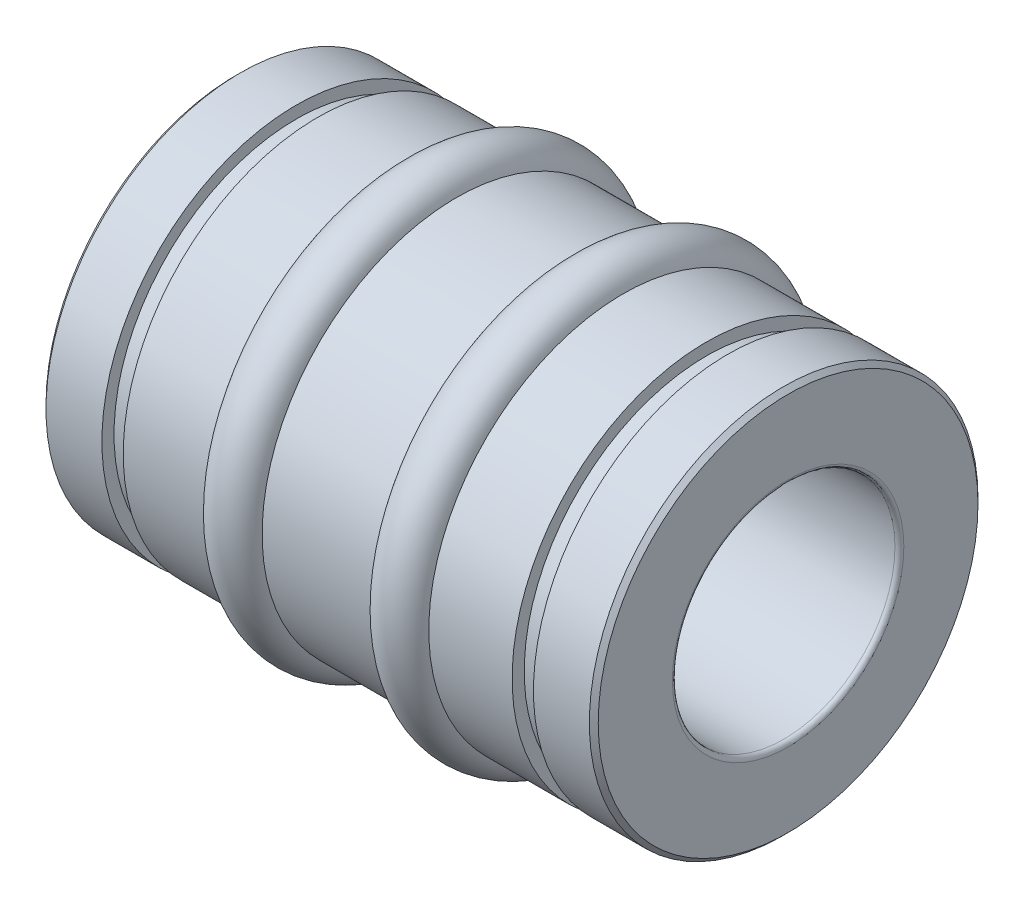
from build123d import *

# Parameters (mm, degrees)
SKETCH2_R = 1.5875


with BuildPart() as part:
    # Sketch1 → Revolve1 (revolve)
    with BuildSketch(Plane.XY, mode=Mode.PRIVATE) as revolve1_sk:
        with BuildLine():
            Line((-15.77975, 10.85215), (-15.77975, 6.61416))
            ThreePointArc((-15.77975, 6.61416), (-15.705355122, 6.434554878), (-15.52575, 6.36016))
            Line((-15.52575, 6.36016), (15.52575, 6.36016))
            ThreePointArc((15.52575, 6.36016), (15.705355122, 6.434554878), (15.77975, 6.61416))
            Line((15.77975, 6.61416), (15.77975, 10.85215))
            Line((15.77975, 10.85215), (15.52575, 11.10615))
            Line((15.52575, 11.10615), (12.3317, 11.10615))
            Line((12.3317, 11.10615), (12.3317, 10.414))
            Line((12.3317, 10.414), (11.1125, 10.414))
            Line((11.1125, 10.414), (11.1125, 11.10615))
            Line((11.1125, 11.10615), (6.35, 11.10615))
            Line((6.35, 11.10615), (6.35, 9.0424))
            Line((6.35, 9.0424), (3.175, 9.0424))
            Line((3.175, 9.0424), (3.175, 11.10615))
            Line((3.175, 11.10615), (-3.175, 11.10615))
            Line((-3.175, 11.10615), (-3.175, 9.0424))
            Line((-3.175, 9.0424), (-6.35, 9.0424))
            Line((-6.35, 9.0424), (-6.35, 11.10615))
            Line((-6.35, 11.10615), (-11.1125, 11.10615))
            Line((-11.1125, 11.10615), (-11.1125, 10.414))
            Line((-11.1125, 10.414), (-12.3317, 10.414))
            Line((-12.3317, 10.414), (-12.3317, 11.10615))
            Line((-12.3317, 11.10615), (-15.52575, 11.10615))
            Line((-15.52575, 11.10615), (-15.77975, 10.85215))
        make_face()
    revolve(revolve1_sk.sketch.rotate(Axis((15.77975, 0, 0), (-1, 0, 0)), 90), axis=Axis((15.77975, 0, 0), (-1, 0, 0)))


with BuildPart() as body_2:
    # Sketch2 → Revolve2 (revolve)
    with BuildSketch(Plane(origin=(0, 0, 0), x_dir=(1, 0, 0), z_dir=(0, 1, 0)), mode=Mode.PRIVATE) as revolve2_sk:
        with Locations((-4.7625, 10.6299)):
            Circle(SKETCH2_R)
        with Locations((4.7625, 10.6299)):
            Circle(SKETCH2_R)
    revolve(revolve2_sk.sketch.rotate(Axis((-15.52575, 0, 0), (1, 0, 0)), 180), axis=Axis((-15.52575, 0, 0), (1, 0, 0)))


solid = Compound([part.part, body_2.part])
